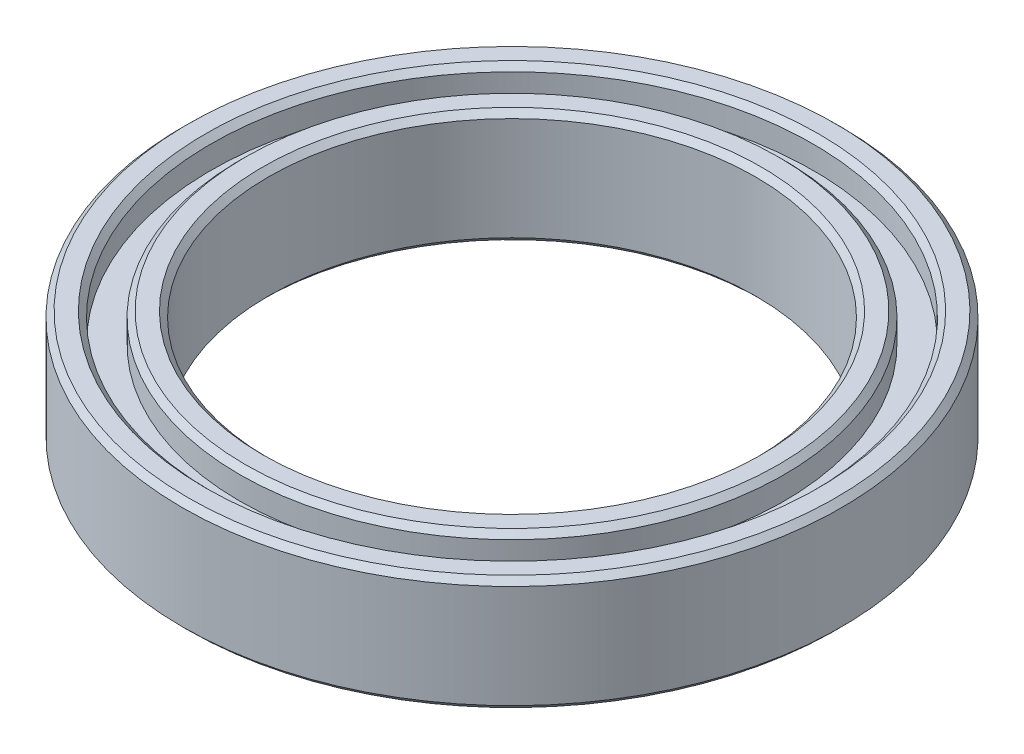
from build123d import *

# Parameters (mm, degrees)
SKETCH1_R           = 11.5
SKETCH1_R_2         = 8.5
BOSS_EXTRUDE1_DEPTH = 4
SKETCH2_R           = 10.5
SKETCH2_R_2         = 9.5
CUT_EXTRUDE1_DEPTH  = 1
CUT_EXTRUDE2_START  = -1
SKETCH3_R           = 10.5
SKETCH3_R_2         = 9.5
CUT_EXTRUDE2_DEPTH  = 1
CHAMFER1_SIZE       = 0.2


with BuildPart() as part:
    # Sketch1 → Boss-Extrude1 (new body)
    with BuildSketch(Plane(origin=(0, 0, 0), x_dir=(1, 0, 0), z_dir=(0, 1, 0))):
        with Locations(Location((0, 0, 0), (0, 0, 270))):
            Circle(SKETCH1_R)
        with Locations(Location((0, 0, 0), (0, 0, 270))):
            Circle(SKETCH1_R_2, mode=Mode.SUBTRACT)
    extrude(amount=BOSS_EXTRUDE1_DEPTH)

    # Sketch2 → Cut-Extrude1 (cut)
    with BuildSketch(Plane(origin=(0, 4, 0), x_dir=(1, 0, 0), z_dir=(0, 1, 0))):
        with Locations(Location((0, 0, 0), (0, 0, 270))):
            Circle(SKETCH2_R)
        with Locations(Location((0, 0, 0), (0, 0, 270))):
            Circle(SKETCH2_R_2, mode=Mode.SUBTRACT)
    extrude(amount=-CUT_EXTRUDE1_DEPTH, mode=Mode.SUBTRACT)

    # Sketch3 → Cut-Extrude2 (cut)
    with BuildSketch(Plane.XZ.offset(CUT_EXTRUDE2_START)):
        with Locations(Location((0, 0, 0), (0, 0, 90))):
            Circle(SKETCH3_R)
        with Locations(Location((0, 0, 0), (0, 0, 90))):
            Circle(SKETCH3_R_2, mode=Mode.SUBTRACT)
    extrude(amount=CUT_EXTRUDE2_DEPTH, mode=Mode.SUBTRACT)

    # Chamfer1
    chamfer1_edges = [part.edges().sort_by_distance(p)[0] for p in [
        (0, 4, -10.5),
        (0, 4, -9.5),
        (0, 0, -11.5),
        (0, 0, -10.5),
        (0, 0, -9.5),
        (0, 4, -11.5),
        (0, 0, -8.5),
        (0, 4, -8.5),
    ]]
    chamfer(chamfer1_edges, length=CHAMFER1_SIZE)


solid = part.part
